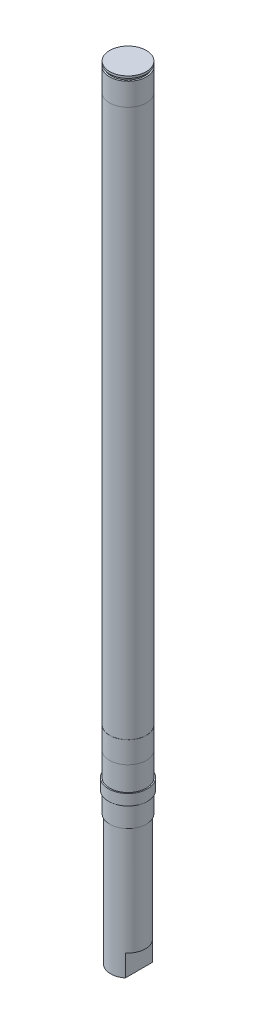
from build123d import *

# Parameters (mm, degrees)
ESQUISSE2_OUTSIDE_W   = 92.28
ESQUISSE2_OUTSIDE_H   = 92.28
ESQUISSE2_OUTSIDE_W_2 = 10
ESQUISSE2_OUTSIDE_H_2 = 24.610755802
EXTRUSION1_DEPTH      = 10


with BuildPart() as part:
    # Esquisse1 → Révolution1 (revolve)
    with BuildSketch(Plane.XY):
        Polygon((0, 0), (8, 0), (8, 60), (8.45, 60), (8.45, 69.4), (9, 69.4), (9, 74.4), (8.45, 74.4), (8.45, 85.5), (8.5, 85.5), (8.5, 95.5), (8.45, 95.5), (8.45, 348), (8.5, 348), (8.5, 358.4), (7.75, 358.4), (7.75, 359.5), (8.45, 359.5), (8.45, 360.5), (0, 360.5), align=None)
    revolve(axis=Axis((0, 0, 0), (0, 1, 0)))

    # Esquisse2 outside → Extrusion1 (cut)
    with BuildSketch(Plane.XZ):
        Rectangle(ESQUISSE2_OUTSIDE_W, ESQUISSE2_OUTSIDE_H)
        Rectangle(ESQUISSE2_OUTSIDE_W_2, ESQUISSE2_OUTSIDE_H_2, mode=Mode.SUBTRACT)
    extrude(amount=-EXTRUSION1_DEPTH, mode=Mode.SUBTRACT)


solid = part.part
